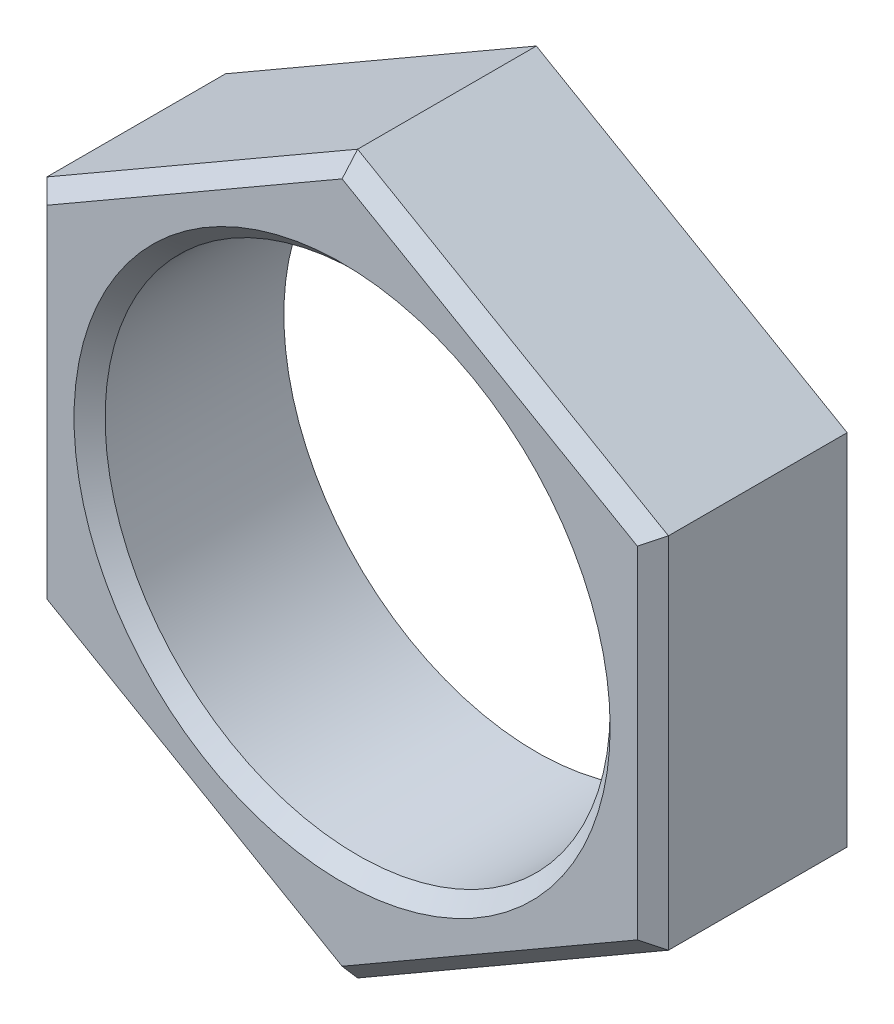
from build123d import *

# Parameters (mm, degrees)
SKETCH1_R           = 20.6375
BOSS_EXTRUDE1_DEPTH = 15.875
CHAMFER1_SIZE       = 1.27


with BuildPart() as part:
    # Sketch1 → Boss-Extrude1 (new body)
    with BuildSketch(Plane.XY):
        Polygon((0, 29.329393675), (-25.4, 14.664696837), (-25.4, -14.664696837), (0, -29.329393675), (25.4, -14.664696837), (25.4, 14.664696837), align=None)
        Circle(SKETCH1_R, mode=Mode.SUBTRACT)
    extrude(amount=BOSS_EXTRUDE1_DEPTH)

    # Chamfer1
    chamfer1_edges = [part.edges().sort_by_distance(p)[0] for p in [
        (-25.4, 0, 15.875),
        (-12.7, -21.997045256, 15.875),
        (12.7, -21.997045256, 15.875),
        (-20.6375, 0, 15.875),
        (25.4, 0, 15.875),
        (12.7, 21.997045256, 15.875),
        (-12.7, 21.997045256, 15.875),
    ]]
    chamfer(chamfer1_edges, length=CHAMFER1_SIZE)


solid = part.part
